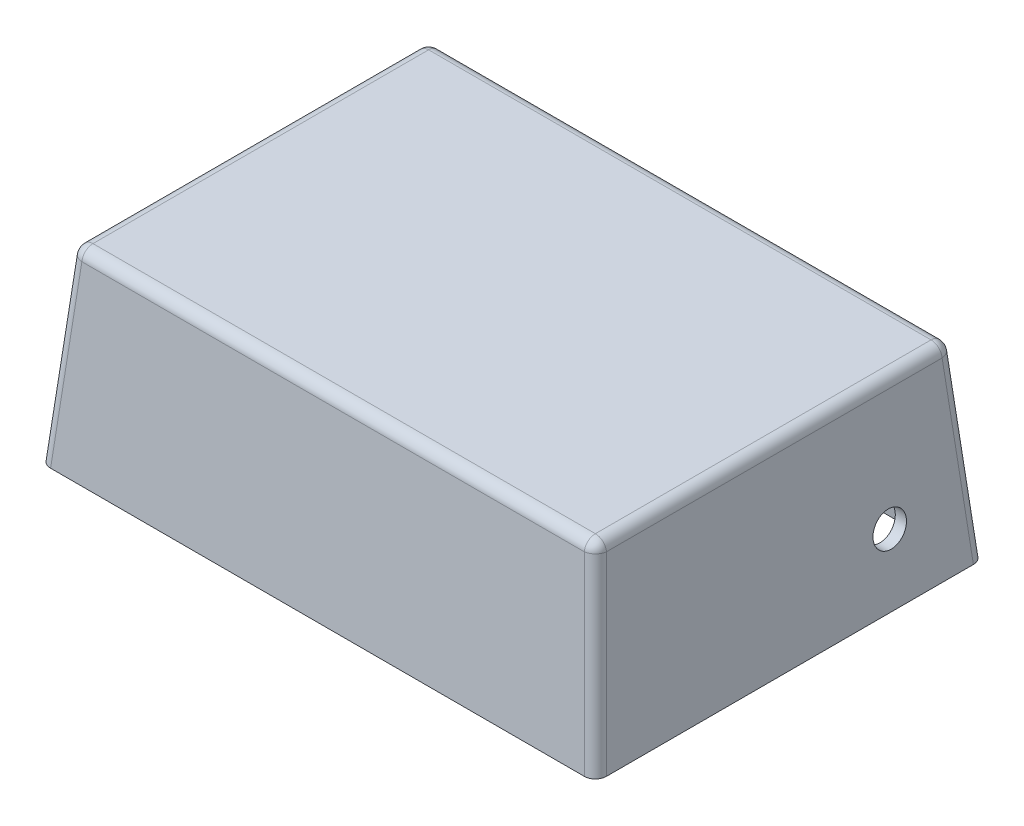
from build123d import *

# Parameters (mm, degrees)
ESQUISSE1_W             = 50
ESQUISSE1_H             = 17
BOSS_EXTRU_1_DEPTH      = 35
D_POUILLE2_ANGLE        = -5
COQUE2_T                = -1
CONG_1_R                = 1
ESQUISSE2_R             = 2
ESQUISSE2_R_2           = 1
BOSS_EXTRU_2_DEPTH      = 14.5
ENL_V_MAT_EXTRU_1_REACH = 48.249
ENL_V_MAT_EXTRU_2_REACH = 48.249
ESQUISSE4_R             = 1.5


with BuildPart() as part:
    # Esquisse1 → Boss.-Extru.1 (new body)
    with BuildSketch(Plane.XY):
        with Locations((0, 8.5)):
            Rectangle(ESQUISSE1_W, ESQUISSE1_H)
    extrude(amount=BOSS_EXTRU_1_DEPTH)

    # Dépouille2
    d_pouille2_faces = [part.faces().sort_by_distance(p)[0] for p in [
        (0, 8.5, 0),
        (25, 8.5, 17.5),
        (-25, 8.5, 17.5),
        (0, 8.5, 35),
    ]]
    draft(d_pouille2_faces, Plane(origin=(-25, 0, 35), x_dir=(-1, 0, 0), z_dir=(0, -1, 0)), D_POUILLE2_ANGLE)

    # Coque2
    coque2_openings = [part.faces().sort_by_distance(p)[0] for p in [
        (0, 0, 17.5),
    ]]
    offset(amount=COQUE2_T, openings=coque2_openings, kind=Kind.INTERSECTION)

    # Congé1
    cong_1_edges = [part.edges().sort_by_distance(p)[0] for p in [
        (24.25634636, 8.5, 34.25634636),
        (0, 17, 33.51269272),
        (-23.296270854, 8, 1.703729146),
        (-22.596361546, 16, 17.5),
        (23.296270854, 8, 1.703729146),
        (0, 16, 2.403638454),
        (22.596361546, 16, 17.5),
        (-23.296270854, 8, 33.296270854),
        (23.296270854, 8, 33.296270854),
        (0, 16, 32.596361546),
        (-24.25634636, 8.5, 34.25634636),
        (0, 17, 1.48730728),
        (24.25634636, 8.5, 0.74365364),
        (-24.25634636, 8.5, 0.74365364),
        (-23.51269272, 17, 17.5),
        (23.51269272, 17, 17.5),
    ]]
    fillet(cong_1_edges, radius=CONG_1_R)

    # Esquisse2 → Boss.-Extru.2 (add)
    # profile 1 of 2: a face of its own
    with BuildSketch(Plane(origin=(0, 16, 0), x_dir=(-1, 0, 0), z_dir=(0, -1, 0))):
        with Locations(Location((-19.25, -29.25, 0), (0, 0, 270))):
            Circle(ESQUISSE2_R)
        with Locations(Location((-19.25, -29.25, 0), (0, 0, 270))):
            Circle(ESQUISSE2_R_2, mode=Mode.SUBTRACT)
    # profile 2 of 2: a face of its own
    with BuildSketch(Plane(origin=(0, 16, 0), x_dir=(-1, 0, 0), z_dir=(0, -1, 0))):
        with Locations(Location((19.25, -5.75, 0), (0, 0, 270))):
            Circle(ESQUISSE2_R)
        with Locations(Location((19.25, -5.75, 0), (0, 0, 270))):
            Circle(ESQUISSE2_R_2, mode=Mode.SUBTRACT)
    extrude(amount=BOSS_EXTRU_2_DEPTH)

    # Esquisse3 → Enlèv. mat.-Extru.1 (cut, up to next)
    with BuildSketch(Plane(origin=(0, 0, 0), x_dir=(0, 0, -1), z_dir=(1, 0, 0)), mode=Mode.PRIVATE) as enl_v_mat_extru_1_sk1:
        with BuildLine():
            Line((-20, 5), (-20, -1))
            Line((-20, -1), (-15, -1))
            Line((-15, -1), (-15, 5))
            ThreePointArc((-15, 5), (-17.5, 7.5), (-20, 5))
        make_face()
    enl_v_mat_extru_1_tool1 = extrude(enl_v_mat_extru_1_sk1.sketch, amount=-ENL_V_MAT_EXTRU_1_REACH, mode=Mode.PRIVATE) & part.part
    add(enl_v_mat_extru_1_tool1.solids().sort_by_distance((0, 3.001296, 17.5))[0], mode=Mode.SUBTRACT)

    # Enlèv. mat.-Extru.2: up to this plane
    enl_v_mat_extru_2_end = Plane(origin=(25, 0, 35), z_dir=(0.9961946980917455, 0.08715574274765836, 0))
    # Esquisse4 → Enlèv. mat.-Extru.2 (cut, up to the surface)
    with BuildSketch(Plane(origin=(0, 0, 0), x_dir=(0, 0, -1), z_dir=(1, 0, 0)), mode=Mode.PRIVATE) as enl_v_mat_extru_2_sk1:
        with Locations(Location((-8, 6, 0), (0, 0, 90))):
            Circle(ESQUISSE4_R)
    enl_v_mat_extru_2_tool1 = split(extrude(enl_v_mat_extru_2_sk1.sketch, amount=ENL_V_MAT_EXTRU_2_REACH, mode=Mode.PRIVATE), bisect_by=enl_v_mat_extru_2_end, keep=Keep.BOTH, mode=Mode.PRIVATE)
    add(enl_v_mat_extru_2_tool1.solids().sort_by_distance((0, 6, 8))[0], mode=Mode.SUBTRACT)


solid = part.part
